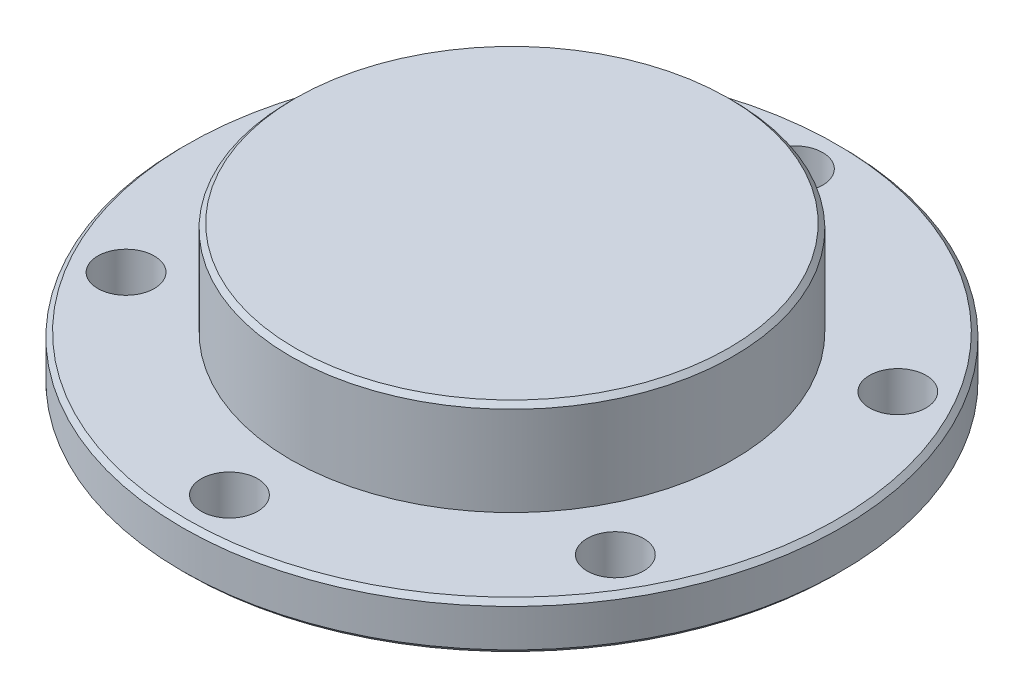
from build123d import *

# Parameters (mm, degrees)
SKETCH_1_R          = 35
EXTRUDE_1_DEPTH     = 5
SKETCH_2_R          = 23.5
EXTRUDE_2_DEPTH     = 10
SKETCH_3_R          = 20
CUT_EXTRUDE_1_DEPTH = 14
SKETCH_4_R          = 3
CUT_EXTRUDE_2_DEPTH = 14
CHAMFER_1_SIZE      = 0.5


with BuildPart() as part:
    # 草图1 → 凸台-拉伸1 (new body)
    with BuildSketch(Plane(origin=(0, 0, 0), x_dir=(1, 0, 0), z_dir=(0, 1, 0))):
        with Locations(Location((0, 0, 0), (0, 0, 270))):
            Circle(SKETCH_1_R)
    extrude(amount=EXTRUDE_1_DEPTH)

    # 草图2 → 凸台-拉伸2 (add)
    with BuildSketch(Plane(origin=(0, 5, 0), x_dir=(1, 0, 0), z_dir=(0, 1, 0))):
        with Locations(Location((0, 0, 0), (0, 0, 270))):
            Circle(SKETCH_2_R)
    extrude(amount=EXTRUDE_2_DEPTH)

    # 草图3 → 切除-拉伸1 (cut)
    with BuildSketch(Plane.XZ):
        with Locations(Location((0, 0, 0), (0, 0, 270))):
            Circle(SKETCH_3_R)
    extrude(amount=-CUT_EXTRUDE_1_DEPTH, mode=Mode.SUBTRACT)

    # 草图4 → 切除-拉伸2 (cut)
    with BuildSketch(Plane(origin=(0, 5, 0), x_dir=(1, 0, 0), z_dir=(0, 1, 0))):
        with Locations(Location((0, 30, 0), (0, 0, 270))):
            Circle(SKETCH_4_R)
        with Locations(Location((25.980762114, 15, 0), (0, 0, 270))):
            Circle(SKETCH_4_R)
        with Locations(Location((25.980762114, -15, 0), (0, 0, 270))):
            Circle(SKETCH_4_R)
        with Locations(Location((0, -30, 0), (0, 0, 270))):
            Circle(SKETCH_4_R)
        with Locations(Location((-25.980762114, -15, 0), (0, 0, 270))):
            Circle(SKETCH_4_R)
        with Locations(Location((-25.980762114, 15, 0), (0, 0, 270))):
            Circle(SKETCH_4_R)
    extrude(amount=-CUT_EXTRUDE_2_DEPTH, mode=Mode.SUBTRACT)

    # Chamfer 1
    chamfer_1_edges = [part.edges().sort_by_distance(p)[0] for p in [
        (0, 0, 20),
        (0, 0, -35),
        (0, 5, -35),
        (0, 15, -23.5),
    ]]
    chamfer(chamfer_1_edges, length=CHAMFER_1_SIZE)


solid = part.part
